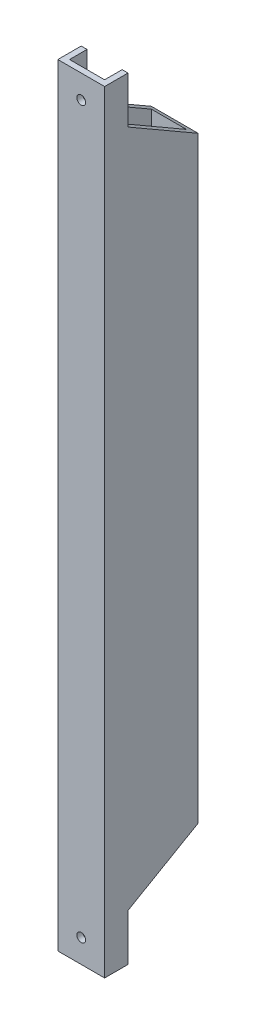
from build123d import *

# Parameters (mm, degrees)
SKETCH1_W              = 25.4
SKETCH1_H              = 50.8
SKETCH1_W_2            = 19.05
SKETCH1_H_2            = 44.45
BOSS_EXTRUDE1_DEPTH    = 419.1
F_10_CLEARANCE_HOLE1_D = 4.7625
CUT_EXTRUDE1_DEPTH     = 423.930975456
CUT_EXTRUDE2_REACH     = 424.931
SKETCH6_R              = 2.1828125


with BuildPart() as part:
    # Sketch1 → Boss-Extrude1 (new body)
    with BuildSketch(Plane(origin=(0, 0, 0), x_dir=(1, 0, 0), z_dir=(0, 1, 0))):
        with Locations((12.7, 25.4)):
            Rectangle(SKETCH1_W, SKETCH1_H)
        with Locations((12.7, 25.4)):
            Rectangle(SKETCH1_W_2, SKETCH1_H_2, mode=Mode.SUBTRACT)
    extrude(amount=BOSS_EXTRUDE1_DEPTH)

    # #10 Clearance Hole1 (through all)
    with Locations(Plane(origin=(0, 0, -50.8), x_dir=(-1, 0, 0), z_dir=(0, 0, -1))):
        with Locations((-12.7, 406.4), (-12.7, 12.7)):
            Hole(F_10_CLEARANCE_HOLE1_D / 2)

    # Sketch5 → Cut-Extrude1 (cut, through all)
    with BuildSketch(Plane(origin=(25.4, 0, 0), x_dir=(0, 0, -1), z_dir=(1, 0, 0))):
        Polygon((12.7, 419.1), (12.7, 393.7), (50.8, 371.702954744), (50.8, 419.1), align=None)
    cut_extrude1 = extrude(amount=-CUT_EXTRUDE1_DEPTH, mode=Mode.SUBTRACT)

    # Mirror1: Cut-Extrude1 across plane
    add(cut_extrude1.mirror(Plane.ZX.offset(209.55)), mode=Mode.SUBTRACT)

    # Sketch6 → Cut-Extrude2 (cut, up to next)
    with BuildSketch(Plane(origin=(0, 0, -50.8), x_dir=(-1, 0, 0), z_dir=(0, 0, -1)), mode=Mode.PRIVATE) as cut_extrude2_sk1:
        with Locations((-12.7, 121.2725)):
            Circle(SKETCH6_R)
    cut_extrude2_tool1 = extrude(cut_extrude2_sk1.sketch, amount=-CUT_EXTRUDE2_REACH, mode=Mode.PRIVATE) & part.part
    # Sketch6 → Cut-Extrude2 (cut, up to next)
    with BuildSketch(Plane(origin=(0, 0, -50.8), x_dir=(-1, 0, 0), z_dir=(0, 0, -1)), mode=Mode.PRIVATE) as cut_extrude2_sk2:
        with Locations((-12.7, 297.8275)):
            Circle(SKETCH6_R)
    cut_extrude2_tool2 = extrude(cut_extrude2_sk2.sketch, amount=-CUT_EXTRUDE2_REACH, mode=Mode.PRIVATE) & part.part
    add(cut_extrude2_tool1.solids().sort_by_distance((12.7, 121.2725, -50.8))[0], mode=Mode.SUBTRACT)
    add(cut_extrude2_tool2.solids().sort_by_distance((12.7, 297.8275, -50.8))[0], mode=Mode.SUBTRACT)


solid = part.part
